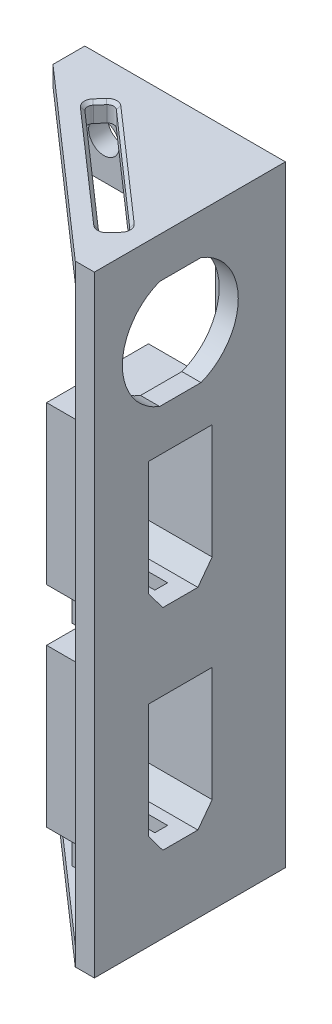
from build123d import *

# Parameters (mm, degrees)
SKETCH4_R           = 2.4
BOSS_EXTRUDE4_DEPTH = 3
BOSS_EXTRUDE5_DEPTH = 30
CUT_EXTRUDE2_START  = -3
CUT_EXTRUDE2_DEPTH  = 148.103937837
SOCKETHOLES_DEPTH   = 3
CUT_EXTRUDE4_DEPTH  = 110
FILLET1_R           = 1
CHAMFER1_SIZE       = 0.5
SKETCH14_W          = 16
SKETCH14_H          = 32
BOSS_EXTRUDE6_DEPTH = 10
CUT_EXTRUDE5_DEPTH  = 10
CHAMFER2_SIZE       = 1
SKETCH18_R          = 1.8
CUT_EXTRUDE7_DEPTH  = 17
SKETCH19_R          = 1.8
CUT_EXTRUDE8_DEPTH  = 4


with BuildPart() as part:
    # Sketch4 → Boss-Extrude4 (new body)
    with BuildSketch(Plane.XY):
        Polygon((130.57, 0), (125.57, 0), (125.57, -34), (102.07, -34), (102.07, -45), (130.57, -45), align=None)
        with Locations((108.07, -40)):
            Circle(SKETCH4_R, mode=Mode.SUBTRACT)
    boss_extrude4 = extrude(amount=BOSS_EXTRUDE4_DEPTH)

    # Sketch4<10> → Boss-Extrude5 (add)
    with BuildSketch(Plane.XY):
        Polygon((133.57, 0), (130.57, 0), (130.57, -45), (102.07, -45), (102.07, -48), (121.666903009, -48), (133.57, -48), align=None)
    boss_extrude5 = extrude(amount=BOSS_EXTRUDE5_DEPTH)

    # Sketch11 → Cut-Extrude2 (cut)
    with BuildSketch(Plane(origin=(0, -45, 0), x_dir=(1, 0, 0), z_dir=(0, 1, 0)).offset(CUT_EXTRUDE2_START)):
        Polygon((102.07, -30), (130.57, -30), (102.07, -5), align=None)
    cut_extrude2 = extrude(amount=CUT_EXTRUDE2_DEPTH, mode=Mode.SUBTRACT)

    # Mirror2: Boss-Extrude4, Boss-Extrude5, Cut-Extrude2 across plane
    add(boss_extrude4.mirror(Plane.ZX))
    add(boss_extrude5.mirror(Plane.ZX))
    add(cut_extrude2.mirror(Plane.ZX), mode=Mode.SUBTRACT)

    # Socket holes → socketholes (cut)
    with BuildSketch(Plane.ZY.offset(-130.57)):
        Polygon((21.5, -33), (21.5, -15), (11.5, -15), (11.5, -33), (13.75, -36), (19.25, -36), align=None)
        with BuildLine():
            Line((19.749615362, 41.6), (13.250384638, 41.6))
            ThreePointArc((13.250384638, 41.6), (7.4, 33.1), (13.250384638, 24.6))
            Line((13.250384638, 24.6), (19.749615362, 24.6))
            ThreePointArc((19.749615362, 24.6), (23.996048952, 27.940615337), (25.6, 33.1))
            ThreePointArc((25.6, 33.1), (23.996048952, 38.259384663), (19.749615362, 41.6))
        make_face()
        Polygon((21.5, 18), (11.5, 18), (11.5, 0), (13.75, -3), (19.25, -3), (21.5, 0), align=None)
    extrude(amount=-SOCKETHOLES_DEPTH, mode=Mode.SUBTRACT)

    # Sketch12 → Cut-Extrude4 (cut)
    with BuildSketch(Plane.XZ.offset(48)):
        Polygon((109.618848481, 7.631156895), (128.261967636, 23.984770189), (130.57, 21.353613294), (111.926880845, 5), align=None)
    extrude(amount=-CUT_EXTRUDE4_DEPTH, mode=Mode.SUBTRACT)

    # Fillet1
    fillet1_edges = [part.edges().sort_by_distance(p)[0] for p in [
        (111.926880845, 46.5, 5),
        (109.618848481, 46.5, 7.631156895),
        (128.261967636, 46.5, 23.984770189),
        (130.57, 46.5, 21.353613294),
        (111.926880845, -46.5, 5),
        (109.618848481, -46.5, 7.631156895),
        (128.261967636, -46.5, 23.984770189),
        (130.57, -46.5, 21.353613294),
    ]]
    fillet(fillet1_edges, radius=FILLET1_R)

    # Chamfer1
    chamfer1_edges = [part.edges().sort_by_distance(p)[0] for p in [
        (110.772864663, 48, 6.315578448),
        (118.940408059, 48, 15.807963542),
        (121.248440423, 48, 13.176806647),
        (129.415983818, 48, 22.669191741),
        (121.248440423, -48, 13.176806647),
        (110.772864663, -48, 6.315578448),
        (118.940408059, -48, 15.807963542),
        (129.415983818, -48, 22.669191741),
        (110.032178493, 48, 7.604116614),
        (111.953921127, 48, 5.413330012),
        (130.156669988, 48, 21.380653575),
        (128.234927355, 48, 23.571440177),
        (111.953921127, -48, 5.413330012),
        (110.032178493, -48, 7.604116614),
        (128.234927355, -48, 23.571440177),
        (130.156669988, -48, 21.380653575),
    ]]
    chamfer(chamfer1_edges, length=CHAMFER1_SIZE)

    # Sketch14 → Boss-Extrude6 (add)
    # profile 1 of 2: a face of its own
    with BuildSketch(Plane.ZY.offset(-130.57)):
        Polygon((8.5, 21), (8.5, -1), (8.5, -11), (24.5, -11), (24.5, -1), (24.5, 21), align=None)
        Polygon((11.5, 0), (11.5, 18), (21.5, 18), (21.5, 0), (19.25, -3), (13.75, -3), align=None, mode=Mode.SUBTRACT)
    # profile 2 of 2: a face of its own
    with BuildSketch(Plane.ZY.offset(-130.57)):
        with Locations((16.5, -28)):
            Rectangle(SKETCH14_W, SKETCH14_H)
        Polygon((21.5, -33), (19.25, -36), (13.75, -36), (11.5, -33), (11.5, -15), (21.5, -15), align=None, mode=Mode.SUBTRACT)
    extrude(amount=BOSS_EXTRUDE6_DEPTH)

    # Sketch15 → Cut-Extrude5 (cut)
    with BuildSketch(Plane.ZY.offset(-120.57)):
        with BuildLine():
            Line((17.5, -36), (17.5, -44))
            ThreePointArc((17.5, -44), (16.5, -45), (15.5, -44))
            Line((15.5, -44), (15.5, -36))
            ThreePointArc((15.5, -36), (16.5, -35), (17.5, -36))
        make_face()
        with BuildLine():
            Line((15.5, -10.714079148), (15.5, -2.714079148))
            ThreePointArc((15.5, -2.714079148), (16.5, -1.714079148), (17.5, -2.714079148))
            Line((17.5, -2.714079148), (17.5, -10.714079148))
            ThreePointArc((17.5, -10.714079148), (16.5, -11.714079148), (15.5, -10.714079148))
        make_face()
    extrude(amount=-CUT_EXTRUDE5_DEPTH, mode=Mode.SUBTRACT)

    # Chamfer2
    chamfer2_edges = [part.edges().sort_by_distance(p)[0] for p in [
        (120.57, -34.5, 12.625),
        (120.57, -24, 11.5),
        (120.57, -15, 16.5),
        (120.57, -24, 21.5),
        (120.57, -34.5, 20.375),
        (120.57, -36, 18.375),
        (120.57, 9, 21.5),
        (120.57, 18, 16.5),
        (120.57, 9, 11.5),
        (120.57, -1.5, 12.625),
        (120.57, -3, 14.625),
        (120.57, -1.5, 20.375),
        (120.57, -3, 18.375),
        (120.57, -36, 14.625),
    ]]
    chamfer(chamfer2_edges, length=CHAMFER2_SIZE)

    # Sketch18 → Cut-Extrude7 (cut)
    with BuildSketch(Plane.XY.offset(24.5)):
        with Locations((125.57, -40)):
            Circle(SKETCH18_R)
        with Locations((125.57, -7)):
            Circle(SKETCH18_R)
    extrude(amount=-CUT_EXTRUDE7_DEPTH, mode=Mode.SUBTRACT)

    # Sketch19 → Cut-Extrude8 (cut)
    # profile 1 of 2: a face of its own
    with BuildSketch(Plane.XY.offset(24.5)):
        with BuildLine():
            Line((128.82, -44), (128.82, -40))
            ThreePointArc((128.82, -40), (127.868097039, -37.701902961), (125.57, -36.75))
            Line((125.57, -36.75), (120.57, -36.75))
            Line((120.57, -36.75), (120.57, -44))
            Line((120.57, -44), (128.82, -44))
        make_face()
        with Locations((125.57, -40)):
            Circle(SKETCH19_R, mode=Mode.SUBTRACT)
    # profile 2 of 2: a face of its own
    with BuildSketch(Plane.XY.offset(24.5)):
        with BuildLine():
            ThreePointArc((128.82, -7), (127.868097039, -4.701902961), (125.57, -3.75))
            Line((125.57, -3.75), (120.57, -3.75))
            Line((120.57, -3.75), (120.57, -11))
            Line((120.57, -11), (128.82, -11))
            Line((128.82, -11), (128.82, -7))
        make_face()
        with Locations((125.57, -7)):
            Circle(SKETCH19_R, mode=Mode.SUBTRACT)
    extrude(amount=-CUT_EXTRUDE8_DEPTH, mode=Mode.SUBTRACT)


solid = part.part
